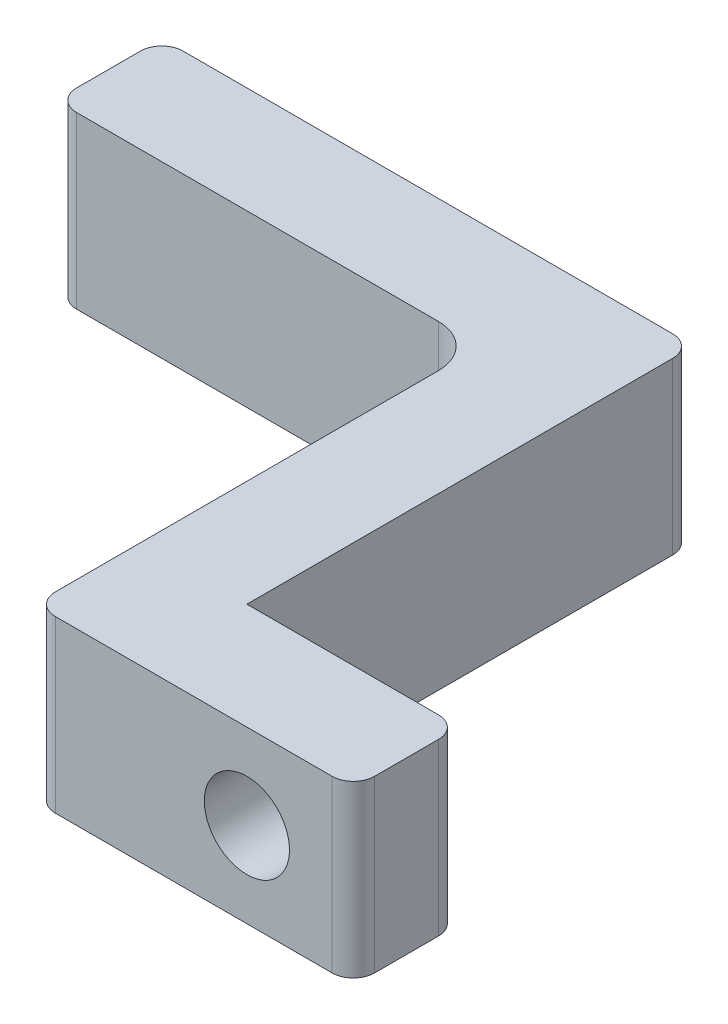
from build123d import *

# Parameters (mm, degrees)
EXTRUDE_1_DEPTH     = 8
SKETCH_2_R          = 2
CUT_EXTRUDE_1_DEPTH = 5
FILLET_1_R          = 1


with BuildPart() as part:
    # 草图1 → 凸台-拉伸1 (new body)
    with BuildSketch(Plane(origin=(0, 0, 0), x_dir=(1, 0, 0), z_dir=(0, 1, 0))):
        with BuildLine():
            Line((-20, 0), (-2, 0))
            ThreePointArc((-2, 0), (-0.585786438, -0.585786438), (0, -2))
            Line((0, -2), (0, -15.720164609))
            Line((0, -15.720164609), (0, -21))
            Line((0, -21), (5, -21))
            Line((5, -21), (15, -21))
            Line((15, -21), (15, -16))
            Line((15, -16), (5, -16))
            Line((5, -16), (5, 0))
            Line((5, 0), (5, 5))
            Line((5, 5), (-20, 5))
            Line((-20, 5), (-20, 0))
        make_face()
    extrude(amount=EXTRUDE_1_DEPTH)

    # 草图2 → 切除-拉伸1 (cut)
    with BuildSketch(Plane(origin=(0, 0, 16), x_dir=(-1, 0, 0), z_dir=(0, 0, -1))):
        with Locations((-10, 4)):
            Circle(SKETCH_2_R)
    extrude(amount=-CUT_EXTRUDE_1_DEPTH, mode=Mode.SUBTRACT)

    # 圆角1
    fillet_1_edges = [part.edges().sort_by_distance(p)[0] for p in [
        (-20, 4, 0),
        (-20, 4, -5),
        (5, 4, -5),
        (15, 4, 16),
        (15, 4, 21),
        (0, 4, 21),
    ]]
    fillet(fillet_1_edges, radius=FILLET_1_R)


solid = part.part
